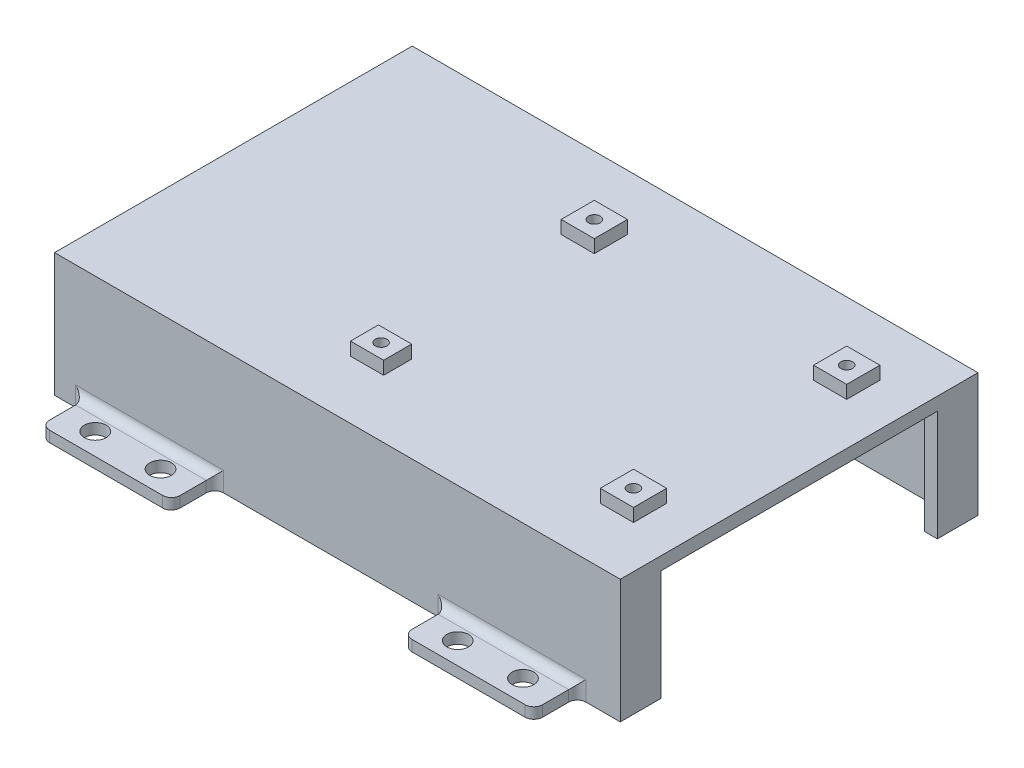
from build123d import *

# Parameters (mm, degrees)
SKETCH1_R                        = 2.54
SKETCH1_R_2                      = 6.35
MAINBASEPLATE_DEPTH              = 3
PIBATTERYBOXBOSS_EXTRUDE3_DEPTH  = 25.4
SKETCH7_W                        = 130
SKETCH7_H                        = 82.2
PIBATTERYTOPBOSS_EXTRUDE4_DEPTH  = 3
SKETCH8_W                        = 63.5
SKETCH8_H                        = 25.4
PIBATTERYWIRESCUT_EXTRUDE2_DEPTH = 13.16
SKETCH9_W                        = 7.62
SKETCH9_H                        = 7.62
SKETCH9_R                        = 1.35
SKETCH9_H_2                      = 6.437586206
PIBOARDBOSS_EXTRUDE5_DEPTH       = 3
SKETCH32_W                       = 712.395528774
SKETCH32_H                       = 524.196017535
CUT_EXTRUDE11_DEPTH              = 3
SKETCH33_W                       = 30
SKETCH33_H                       = 10
SKETCH33_R                       = 2.5
BOSS_EXTRUDE9_DEPTH              = 2.5
FILLET2_R                        = 2
CUT_EXTRUDE12_START              = -5
SKETCH9_2_R                      = 1.35
CUT_EXTRUDE12_DEPTH              = 5


with BuildPart() as part:
    # Sketch1 → mainbaseplate (new body)
    with BuildSketch(Plane(origin=(0, 0, 0), x_dir=(1, 0, 0), z_dir=(0, 1, 0))):
        with BuildLine():
            Line((-223.52, -111.125), (223.52, -111.125))
            ThreePointArc((223.52, -111.125), (227.112102448, -109.637102448), (228.6, -106.045))
            Line((228.6, -106.045), (228.6, 106.045))
            ThreePointArc((228.6, 106.045), (227.112102448, 109.637102448), (223.52, 111.125))
            Line((223.52, 111.125), (-223.52, 111.125))
            ThreePointArc((-223.52, 111.125), (-227.112102448, 109.637102448), (-228.6, 106.045))
            Line((-228.6, 106.045), (-228.6, -106.045))
            ThreePointArc((-228.6, -106.045), (-227.112102448, -109.637102448), (-223.52, -111.125))
        make_face()
        with Locations(Location((127, 36.5125, 0), (0, 0, 270))):
            Circle(SKETCH1_R, mode=Mode.SUBTRACT)
        with Locations(Location((127, -36.5125, 0), (0, 0, 270))):
            Circle(SKETCH1_R, mode=Mode.SUBTRACT)
        with Locations(Location((-142.24, 36.5125, 0), (0, 0, 270))):
            Circle(SKETCH1_R, mode=Mode.SUBTRACT)
        with Locations(Location((-142.24, -36.5125, 0), (0, 0, 270))):
            Circle(SKETCH1_R, mode=Mode.SUBTRACT)
        with Locations(Location((209.55, 0, 0), (0, 0, 270))):
            Circle(SKETCH1_R_2, mode=Mode.SUBTRACT)
    extrude(amount=MAINBASEPLATE_DEPTH)

    # Sketch6 → PiBatteryBoxBoss-Extrude3 (add)
    with BuildSketch(Plane(origin=(0, 3, 0), x_dir=(1, 0, 0), z_dir=(0, 1, 0))):
        Polygon((-63.5, -41.1), (66.5, -41.1), (66.5, 41.1), (-63.5, 41.1), (-63.5, 38.1), (63.5, 38.1), (63.5, -38.1), (-63.5, -38.1), align=None)
    extrude(amount=PIBATTERYBOXBOSS_EXTRUDE3_DEPTH)

    # Sketch7 → PibatterytopBoss-Extrude4 (add)
    with BuildSketch(Plane(origin=(0, 28.4, 0), x_dir=(1, 0, 0), z_dir=(0, 1, 0))):
        with Locations((1.5, 0)):
            Rectangle(SKETCH7_W, SKETCH7_H)
    extrude(amount=PIBATTERYTOPBOSS_EXTRUDE4_DEPTH)

    # Sketch8 → pibatterywiresCut-Extrude2 (cut)
    with BuildSketch(Plane(origin=(66.5, 0, 0), x_dir=(0, 0, -1), z_dir=(1, 0, 0))):
        with Locations((0, 15.7)):
            Rectangle(SKETCH8_W, SKETCH8_H)
    extrude(amount=-PIBATTERYWIRESCUT_EXTRUDE2_DEPTH, mode=Mode.SUBTRACT)

    # Sketch9 → PiBoardBoss-Extrude5 (add)
    # profile 1 of 4: a face of its own
    with BuildSketch(Plane(origin=(0, 31.4, 0), x_dir=(1, 0, 0), z_dir=(0, 1, 0))):
        with Locations((52.92, 24.511)):
            Rectangle(SKETCH9_W, SKETCH9_H)
        with Locations(Location((52.92, 24.511, 0), (0, 0, 270))):
            Circle(SKETCH9_R, mode=Mode.SUBTRACT)
    # profile 2 of 4: a face of its own
    with BuildSketch(Plane(origin=(0, 31.4, 0), x_dir=(1, 0, 0), z_dir=(0, 1, 0))):
        with Locations((52.92, -24.489)):
            Rectangle(SKETCH9_W, SKETCH9_H)
        with Locations(Location((52.92, -24.489, 0), (0, 0, 270))):
            Circle(SKETCH9_R, mode=Mode.SUBTRACT)
    # profile 3 of 4: a face of its own
    with BuildSketch(Plane(origin=(0, 31.4, 0), x_dir=(1, 0, 0), z_dir=(0, 1, 0))):
        with Locations((-5.08, 24.511)):
            Rectangle(SKETCH9_W, SKETCH9_H)
        with Locations(Location((-5.08, 24.511, 0), (0, 0, 270))):
            Circle(SKETCH9_R, mode=Mode.SUBTRACT)
    # profile 4 of 4: a face of its own
    with BuildSketch(Plane(origin=(0, 31.4, 0), x_dir=(1, 0, 0), z_dir=(0, 1, 0))):
        with Locations((-5.08, -24.489)):
            Rectangle(SKETCH9_W, SKETCH9_H_2)
        with Locations(Location((-5.08, -24.489, 0), (0, 0, 270))):
            Circle(SKETCH9_R, mode=Mode.SUBTRACT)
    extrude(amount=PIBOARDBOSS_EXTRUDE5_DEPTH)

    # Sketch32 → Cut-Extrude11 (cut)
    with BuildSketch(Plane.XZ):
        with Locations((-5.907824988, 36.768742763)):
            Rectangle(SKETCH32_W, SKETCH32_H)
    extrude(amount=-CUT_EXTRUDE11_DEPTH, mode=Mode.SUBTRACT)

    # Sketch33 → Boss-Extrude9 (add)
    # profile 1 of 4: a face of its own
    with BuildSketch(Plane.XZ.offset(-3)):
        with Locations((-41.638953423, 46.1)):
            Rectangle(SKETCH33_W, SKETCH33_H)
        with Locations(Location((-49.138953423, 46.1, 0), (0, 0, 270))):
            Circle(SKETCH33_R, mode=Mode.SUBTRACT)
        with Locations(Location((-34.138953423, 46.1, 0), (0, 0, 90))):
            Circle(SKETCH33_R, mode=Mode.SUBTRACT)
    # profile 2 of 4: a face of its own
    with BuildSketch(Plane.XZ.offset(-3)):
        with Locations((41.638953423, 46.1)):
            Rectangle(SKETCH33_W, SKETCH33_H)
        with Locations(Location((34.138953423, 46.1, 0), (0, 0, 270))):
            Circle(SKETCH33_R, mode=Mode.SUBTRACT)
        with Locations(Location((49.138953423, 46.1, 0), (0, 0, 90))):
            Circle(SKETCH33_R, mode=Mode.SUBTRACT)
    # profile 3 of 4: a face of its own
    with BuildSketch(Plane.XZ.offset(-3)):
        with Locations((41.638953423, -46.1)):
            Rectangle(SKETCH33_W, SKETCH33_H)
        with Locations(Location((49.138953423, -46.1, 0), (0, 0, 270))):
            Circle(SKETCH33_R, mode=Mode.SUBTRACT)
        with Locations(Location((34.138953423, -46.1, 0), (0, 0, 90))):
            Circle(SKETCH33_R, mode=Mode.SUBTRACT)
    # profile 4 of 4: a face of its own
    with BuildSketch(Plane.XZ.offset(-3)):
        with Locations((-41.638953423, -46.1)):
            Rectangle(SKETCH33_W, SKETCH33_H)
        with Locations(Location((-49.138953423, -46.1, 0), (0, 0, 90))):
            Circle(SKETCH33_R, mode=Mode.SUBTRACT)
        with Locations(Location((-34.138953423, -46.1, 0), (0, 0, 270))):
            Circle(SKETCH33_R, mode=Mode.SUBTRACT)
    extrude(amount=-BOSS_EXTRUDE9_DEPTH)

    # Fillet2
    fillet2_edges = [part.edges().sort_by_distance(p)[0] for p in [
        (-56.638953423, 4.25, 41.1),
        (-56.638953423, 4.25, 51.1),
        (-26.638953423, 4.25, 51.1),
        (-41.638953423, 5.5, 41.1),
        (-26.638953423, 4.25, 41.1),
        (56.638953423, 4.25, 51.1),
        (41.638953423, 5.5, 41.1),
        (56.638953423, 4.25, 41.1),
        (26.638953423, 4.25, 41.1),
        (26.638953423, 4.25, 51.1),
        (41.638953423, 5.5, -41.1),
        (26.638953423, 4.25, -41.1),
        (56.638953423, 4.25, -41.1),
        (56.638953423, 4.25, -51.1),
        (26.638953423, 4.25, -51.1),
        (-56.638953423, 4.25, -51.1),
        (-41.638953423, 5.5, -41.1),
        (-56.638953423, 4.25, -41.1),
        (-26.638953423, 4.25, -41.1),
        (-26.638953423, 4.25, -51.1),
    ]]
    fillet(fillet2_edges, radius=FILLET2_R)

    # Sketch9<2> → Cut-Extrude12 (cut)
    with BuildSketch(Plane(origin=(0, 31.4, 0), x_dir=(1, 0, 0), z_dir=(0, 1, 0)).offset(CUT_EXTRUDE12_START)):
        with Locations(Location((52.92, -24.489, 0), (0, 0, 90))):
            Circle(SKETCH9_2_R)
        with Locations(Location((-5.08, -24.489, 0), (0, 0, 90))):
            Circle(SKETCH9_2_R)
        with Locations(Location((-5.08, 24.511, 0), (0, 0, 90))):
            Circle(SKETCH9_2_R)
        with Locations(Location((52.92, 24.511, 0), (0, 0, 90))):
            Circle(SKETCH9_2_R)
    extrude(amount=CUT_EXTRUDE12_DEPTH, mode=Mode.SUBTRACT)


solid = part.part
